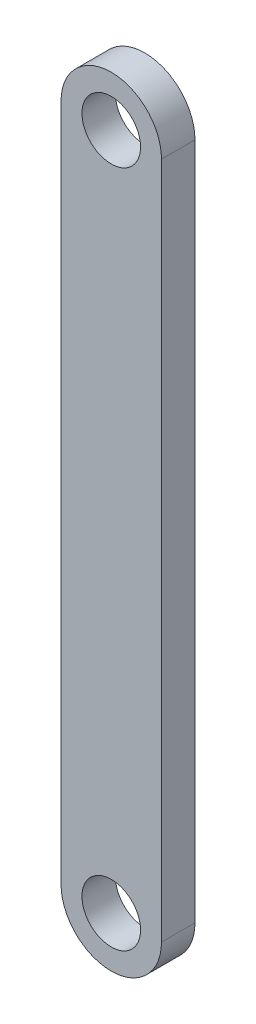
from build123d import *

# Parameters (mm, degrees)
SKETCH1_R           = 11.1125
BOSS_EXTRUDE1_DEPTH = 12.7


with BuildPart() as part:
    # Sketch1 → Boss-Extrude1 (new body)
    with BuildSketch(Plane.XY):
        with BuildLine():
            Line((-19.05, 0), (-19.05, 257.175))
            ThreePointArc((-19.05, 257.175), (0, 276.225), (19.05, 257.175))
            Line((19.05, 257.175), (19.05, 0))
            ThreePointArc((19.05, 0), (0, -19.05), (-19.05, 0))
        make_face()
        with Locations((0, 257.175)):
            Circle(SKETCH1_R, mode=Mode.SUBTRACT)
        Circle(SKETCH1_R, mode=Mode.SUBTRACT)
    extrude(amount=BOSS_EXTRUDE1_DEPTH)


solid = part.part
